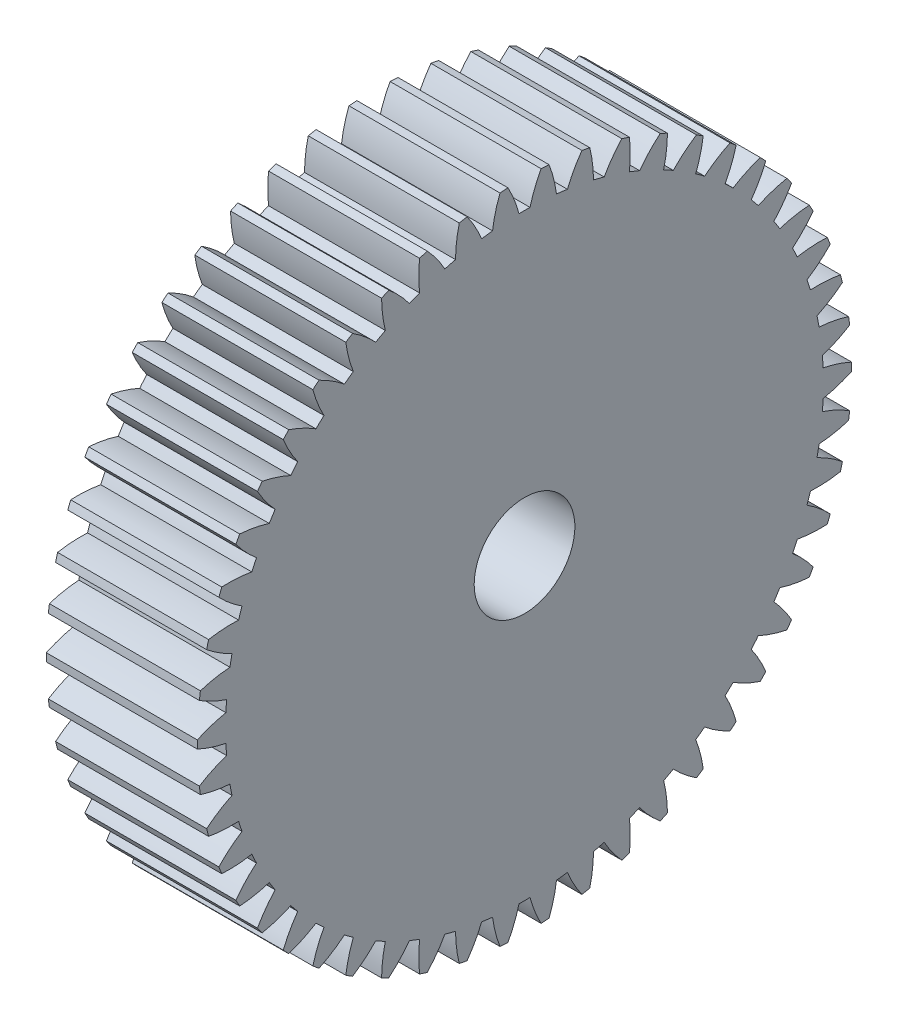
from build123d import *

# Parameters (mm, degrees)
BASPROSKE_W     = 12
BASPROSKE_H     = 26
TOOTHCUT_DEPTH  = 39.678159212
TEETHCUTS_COUNT = 50
TEETHCUTS_ANGLE = 352.8
BORSKE_R        = 4
BORE_DEPTH      = 50.0000508


with BuildPart() as part:
    # BasProSke → Base-Revolve (revolve)
    with BuildSketch(Plane(origin=(0, 0, 0), x_dir=(1, 0, 0), z_dir=(0, 1, 0)), mode=Mode.PRIVATE) as base_revolve_sk:
        with Locations((6, 13)):
            Rectangle(BASPROSKE_W, BASPROSKE_H)
    revolve(base_revolve_sk.sketch.rotate(Axis((-10, 0, 0), (1, 0, 0)), 180), axis=Axis((-10, 0, 0), (1, 0, 0)))

    # TooCutSke → ToothCut (cut, through all)
    with BuildSketch(Plane(origin=(0, 0, 0), x_dir=(0, 0, -1), z_dir=(1, 0, 0))):
        with BuildLine():
            ThreePointArc((0.437663408, 23.744966872), (0, 23.749), (-0.437663408, 23.744966872))
            ThreePointArc((-0.437663408, 23.744966872), (-0.815428123, 24.895236298), (-1.329433358, 25.991422664))
            ThreePointArc((-1.329433358, 25.991422664), (0, 26.0254), (1.329433358, 25.991422664))
            ThreePointArc((1.329433358, 25.991422664), (0.815428123, 24.895236298), (0.437663408, 23.744966872))
        make_face()
    toothcut = extrude(amount=TOOTHCUT_DEPTH, mode=Mode.SUBTRACT)

    # TeethCuts: ToothCut ×50 about axis
    teethcuts_axis = Axis((-10, 0, 0), (1, 0, 0))
    for i in range(1, TEETHCUTS_COUNT):
        add(toothcut.rotate(teethcuts_axis, i * TEETHCUTS_ANGLE / (TEETHCUTS_COUNT - 1)), mode=Mode.SUBTRACT)

    # BorSke → Bore (cut, symmetric)
    with BuildSketch(Plane(origin=(0, 0, 0), x_dir=(0, 0, -1), z_dir=(1, 0, 0))):
        with Locations(Location((0, 0, 0), (0, 0, 180))):
            Circle(BORSKE_R)
    extrude(amount=BORE_DEPTH, both=True, mode=Mode.SUBTRACT)


solid = part.part
